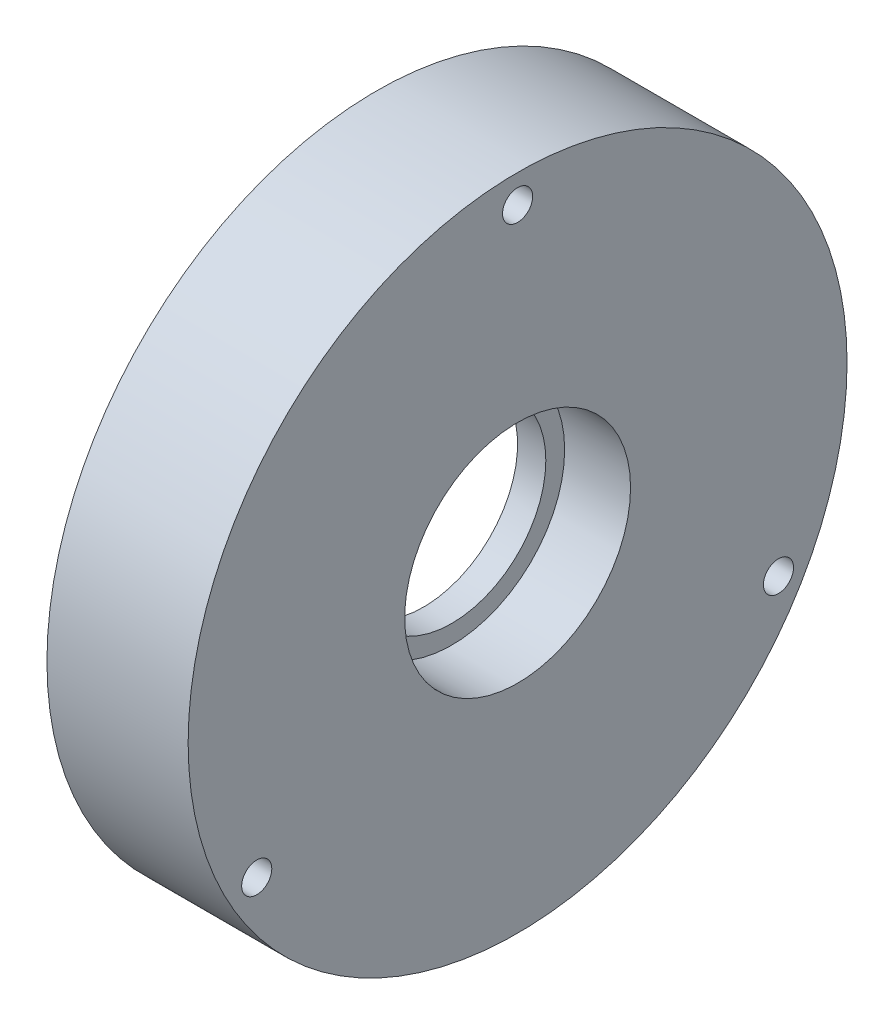
from build123d import *

# Parameters (mm, degrees)
BASPROSKE_W         = 5
BASPROSKE_H         = 4.25
TOOTHCUT_DEPTH      = 26.248762346
TEETHCUTS_COUNT     = 55
TEETHCUTS_ANGLE     = 353.454545455
BOSS_EXTRUDE1_START = 2.5
SKETCH1_R           = 17.5
SKETCH1_R_2         = 5
BOSS_EXTRUDE1_DEPTH = 2.5
SKETCH2_R           = 7.75
SKETCH2_R_2         = 5
BOSS_EXTRUDE2_DEPTH = 2.5
SKETCH3_R           = 6
CUT_EXTRUDE1_DEPTH  = 3.5
CIRPATTERN1_COUNT   = 3


with BuildPart() as part:
    # BasProSke → Base-Revolve (revolve)
    with BuildSketch(Plane(origin=(0, 0, 0), x_dir=(1, 0, 0), z_dir=(0, 1, 0)), mode=Mode.PRIVATE) as base_revolve_sk:
        with Locations((2.5, 15.375)):
            Rectangle(BASPROSKE_W, BASPROSKE_H)
    revolve(base_revolve_sk.sketch.rotate(Axis((-10, 0, 0), (1, 0, 0)), 180), axis=Axis((-10, 0, 0), (1, 0, 0)))

    # TooCutSke → ToothCut (cut, through all)
    with BuildSketch(Plane(origin=(0, 0, 0), x_dir=(0, 0, -1), z_dir=(1, 0, 0))):
        with BuildLine():
            ThreePointArc((0.61765291, 13.210168434), (0.417066145, 13.802967889), (0.163405078, 14.375071297))
            ThreePointArc((0.163405078, 14.375071297), (0, 14.376), (-0.163405078, 14.375071297))
            ThreePointArc((-0.163405078, 14.375071297), (-0.417066145, 13.802967889), (-0.61765291, 13.210168434))
            ThreePointArc((-0.61765291, 13.210168434), (0, 13.2246), (0.61765291, 13.210168434))
        make_face()
    toothcut = extrude(amount=TOOTHCUT_DEPTH, mode=Mode.SUBTRACT)

    # TeethCuts: ToothCut ×55 about axis
    teethcuts_axis = Axis((-10, 0, 0), (1, 0, 0))
    for i in range(1, TEETHCUTS_COUNT):
        add(toothcut.rotate(teethcuts_axis, i * TEETHCUTS_ANGLE / (TEETHCUTS_COUNT - 1)), mode=Mode.SUBTRACT)

    # Sketch1 → Boss-Extrude1 (add)
    with BuildSketch(Plane(origin=(5, 0, 0), x_dir=(0, 0, -1), z_dir=(1, 0, 0)).offset(BOSS_EXTRUDE1_START)):
        with Locations(Location((0, 0, 0), (0, 0, 180))):
            Circle(SKETCH1_R)
        Circle(SKETCH1_R_2, mode=Mode.SUBTRACT)
    extrude(amount=-BOSS_EXTRUDE1_DEPTH)

    # Sketch2 → Boss-Extrude2 (add)
    with BuildSketch(Plane.ZY.offset(-5)):
        with Locations(Location((0, 0, 0), (0, 0, 180))):
            Circle(SKETCH2_R)
        Circle(SKETCH2_R_2, mode=Mode.SUBTRACT)
    extrude(amount=BOSS_EXTRUDE2_DEPTH)

    # Sketch3 → Cut-Extrude1 (cut)
    with BuildSketch(Plane(origin=(7.5, 0, 0), x_dir=(0, 0, -1), z_dir=(1, 0, 0))):
        Circle(SKETCH3_R)
    extrude(amount=-CUT_EXTRUDE1_DEPTH, mode=Mode.SUBTRACT)

    # Sketch6 → M2 Tapped Hole1 (revolve, cut)
    with BuildSketch(Plane(origin=(7.5, 16, 0), x_dir=(0, 0, -1), z_dir=(0, 1, 0))):
        Polygon((0, 0), (0, 5.680688495), (0.8, 5.2), (0.8, 0), align=None)
    m2_tapped_hole1 = revolve(axis=Axis((13.85, 16, 0), (-1, 0, 0)), mode=Mode.SUBTRACT)

    # CirPattern1: M2 Tapped Hole1 ×3 about axis
    cirpattern1_axis = Axis((0, 0, 0), (1, 0, 0))
    for i in range(1, CIRPATTERN1_COUNT):
        add(m2_tapped_hole1.rotate(cirpattern1_axis, i * 360 / CIRPATTERN1_COUNT), mode=Mode.SUBTRACT)


solid = part.part
